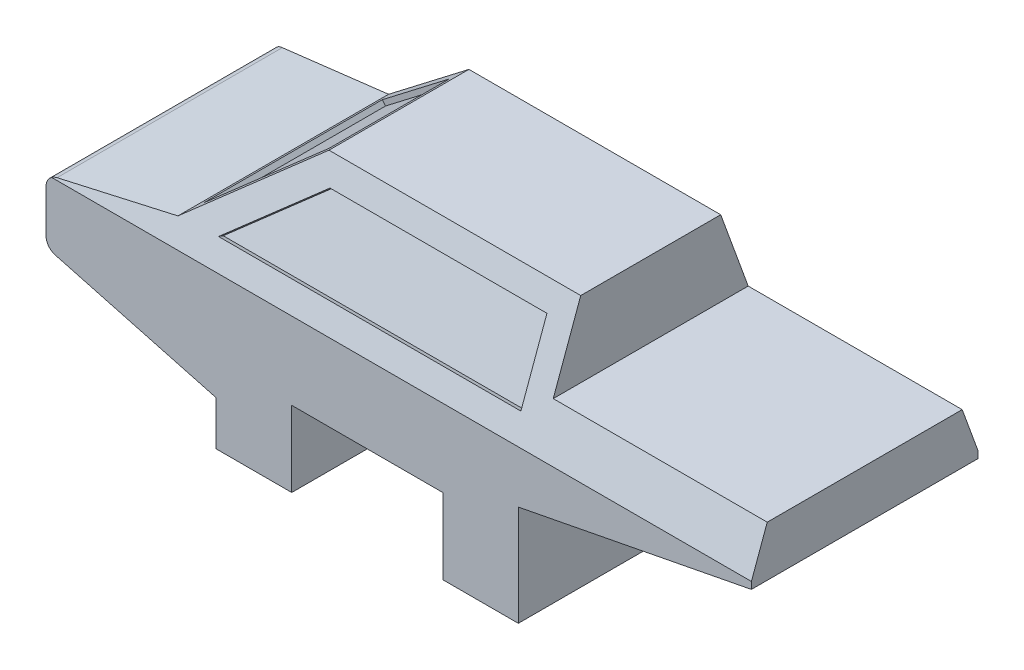
from build123d import *

# Parameters (mm, degrees)
BOSS_EXTRUDE1_DEPTH = 90
CUT_EXTRUDE1_DEPTH  = 337
CUT_EXTRUDE3_DEPTH  = 2
CUT_EXTRUDE4_DEPTH  = 2
CUT_EXTRUDE5_DEPTH  = 2
FILLET1_R           = 5


with BuildPart() as part:
    # Sketch1 → Boss-Extrude1 (new body)
    with BuildSketch(Plane.XY):
        Polygon((-125.894137159, -28.704779811), (-125.894137159, -3.704779811), (-76.653749508, 4.977629073), (-30.691082921, 43.544885654), (69.308917079, 43.544885654), (69.308917079, 13.544885654), (154.308917079, 13.544885654), (154.308917079, -6.455114346), (61.720670681, -24.411045774), (61.720670681, -64.411045774), (31.720670681, -64.411045774), (31.720670681, -34.411045774), (-28.279329319, -34.411045774), (-28.279329319, -64.411045774), (-58.279329319, -64.411045774), (-58.279329319, -46.822112968), align=None)
    extrude(amount=-BOSS_EXTRUDE1_DEPTH)

    # Sketch2 → Cut-Extrude1 (cut)
    with BuildSketch(Plane.ZY.offset(125.894137159)):
        Polygon((-45, 119.931704065), (0, -3.704779811), (0, 165.601573034), (-28.377527092, 165.601573034), align=None)
        Polygon((-90, -3.704779811), (-45, 119.931704065), (-61.622472908, 165.601573034), (-90, 165.601573034), align=None)
    extrude(amount=-CUT_EXTRUDE1_DEPTH, mode=Mode.SUBTRACT)

    # Sketch4 → Cut-Extrude3 (cut)
    with BuildSketch(Plane(origin=(0, -0.433376912, -1.190693279), x_dir=(1, 0, 0), z_dir=(0, 0.34202014332566305, 0.9396926207859105))):
        Polygon((-60.788441179, 6.51864575), (59.308917079, 6.51864575), (59.308917079, 36.800689495), (-26.876123748, 36.800689495), align=None)
    extrude(amount=-CUT_EXTRUDE3_DEPTH, mode=Mode.SUBTRACT)

    # Sketch5 → Cut-Extrude4 (cut)
    with BuildSketch(Plane(origin=(-34.122486649, 40.665596052, 0), x_dir=(0.766044443118979, 0.6427876096865383, 0), z_dir=(-0.6427876096865383, 0.766044443118979, 0))):
        Polygon((-50.520620561, 80.535068722), (-50.520620561, 9.464931278), (-0.520620561, 21.162709123), (-0.520620561, 68.837290877), align=None)
    extrude(amount=-CUT_EXTRUDE4_DEPTH, mode=Mode.SUBTRACT)

    # Sketch7 → Cut-Extrude5 (cut)
    with BuildSketch(Plane(origin=(0, 28.492065524, -78.281306661), x_dir=(-1, 0, 0), z_dir=(0, 0.34202014332566305, -0.9396926207859105))):
        Polygon((60.788441179, -24.263167149), (26.876123748, 6.018876595), (-59.308917079, 6.018876595), (-59.308917079, -24.263167149), align=None)
    extrude(amount=-CUT_EXTRUDE5_DEPTH, mode=Mode.SUBTRACT)

    # Fillet1
    fillet1_edges = [part.edges().sort_by_distance(p)[0] for p in [
        (-125.894137159, -28.704779811, -45),
        (-125.894137159, -3.704779811, -45),
    ]]
    fillet(fillet1_edges, radius=FILLET1_R)


solid = part.part
